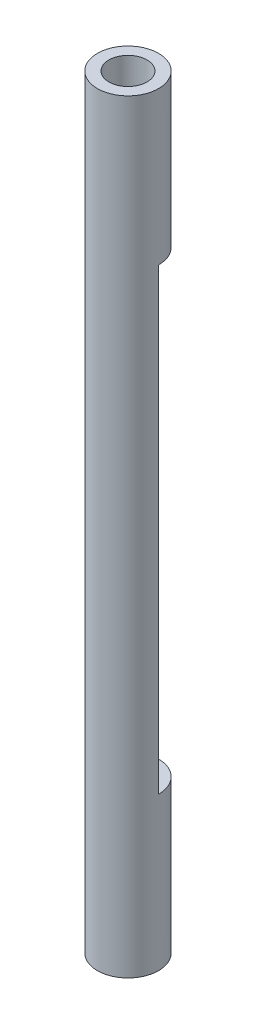
from build123d import *

# Parameters (mm, degrees)
SKETCH_1_R               = 4
SKETCH_1_R_2             = 2.5
EXTRUDE_1_DEPTH          = 100
CUT_EXTRUDE_1_DEPTH      = 101.159872204
CUT_EXTRUDE_1_DEPTH_BACK = 101.159872204
SKETCH_2_W               = 8
SKETCH_2_H               = 60


with BuildPart() as part:
    # 草图1 → 凸台-拉伸1 (new body)
    with BuildSketch(Plane(origin=(0, 0, 0), x_dir=(1, 0, 0), z_dir=(0, 1, 0))):
        with Locations(Location((0, 0, 0), (0, 0, 270))):
            Circle(SKETCH_1_R)
        with Locations(Location((0, 0, 0), (0, 0, 270))):
            Circle(SKETCH_1_R_2, mode=Mode.SUBTRACT)
    extrude(amount=EXTRUDE_1_DEPTH)

    # 草图2 → 切除-拉伸1 (cut, two sides: drawn at the far end of the back side and taken through both)
    with BuildSketch(Plane(origin=(0, 0, 0), x_dir=(0, 0, -1), z_dir=(1, 0, 0)).offset(-CUT_EXTRUDE_1_DEPTH_BACK)):
        with Locations((4, 50)):
            Rectangle(SKETCH_2_W, SKETCH_2_H)
    extrude(amount=CUT_EXTRUDE_1_DEPTH + CUT_EXTRUDE_1_DEPTH_BACK, mode=Mode.SUBTRACT)


solid = part.part
